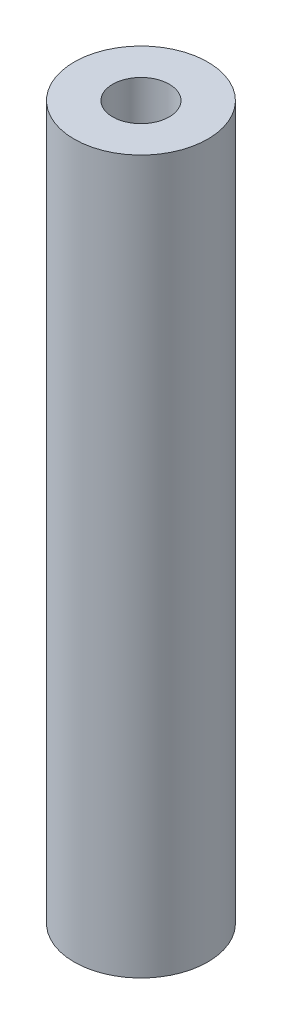
from build123d import *

# Parameters (mm, degrees)
SKETCH1_R           = 4.7625
SKETCH1_R_2         = 2.0193
BOSS_EXTRUDE1_DEPTH = 50.8


with BuildPart() as part:
    # Sketch1 → Boss-Extrude1 (new body)
    with BuildSketch(Plane(origin=(0, 0, 0), x_dir=(1, 0, 0), z_dir=(0, 1, 0))):
        with Locations(Location((0, 0, 0), (0, 0, 270))):
            Circle(SKETCH1_R)
        with Locations(Location((0, 0, 0), (0, 0, 270))):
            Circle(SKETCH1_R_2, mode=Mode.SUBTRACT)
    extrude(amount=BOSS_EXTRUDE1_DEPTH)


solid = part.part
